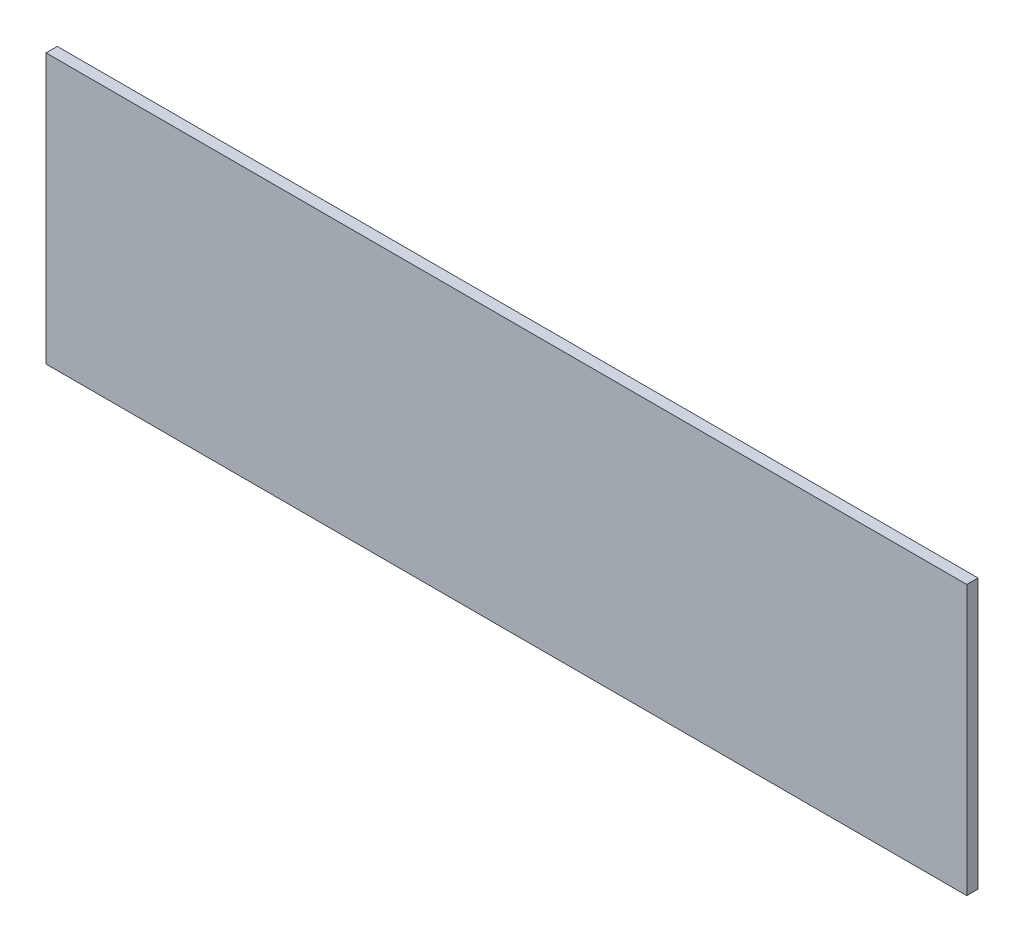
from build123d import *

# Parameters (mm, degrees)
SKETCH_1_W      = 410
SKETCH_1_H      = 120
EXTRUDE_1_DEPTH = 5


with BuildPart() as part:
    # 스케치1 → 보스-돌출1 (new body)
    with BuildSketch(Plane.XY):
        Rectangle(SKETCH_1_W, SKETCH_1_H)
    extrude(amount=EXTRUDE_1_DEPTH)


solid = part.part
